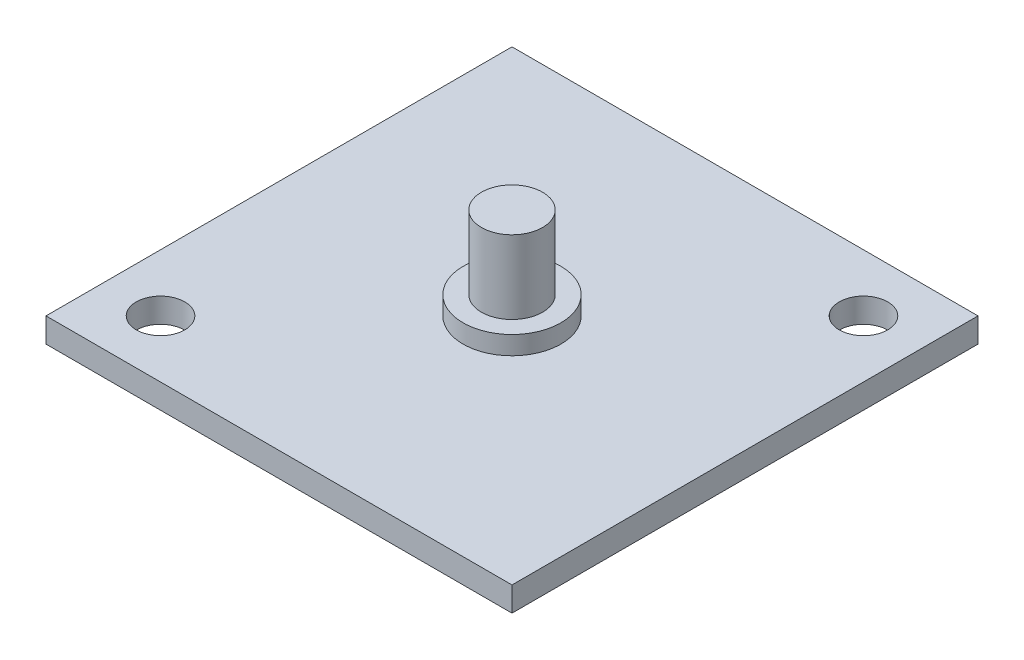
from build123d import *

# Parameters (mm, degrees)
SKETCH1_W           = 38.1
SKETCH1_H           = 38.1
SKETCH1_R           = 1.984375
BOSS_EXTRUDE1_DEPTH = 2
SKETCH2_R           = 4.0005
BOSS_EXTRUDE2_DEPTH = 1.508000032
SKETCH3_R           = 2.5
BOSS_EXTRUDE3_DEPTH = 6


with BuildPart() as part:
    # Sketch1 → Boss-Extrude1 (new body)
    with BuildSketch(Plane(origin=(0, 0, 0), x_dir=(1, 0, 0), z_dir=(0, 1, 0))):
        Rectangle(SKETCH1_W, SKETCH1_H)
        with Locations(Location((14.368409794, 14.368409794, 0), (0, 0, 270))):
            Circle(SKETCH1_R, mode=Mode.SUBTRACT)
        with Locations(Location((-14.368409794, -14.368409794, 0), (0, 0, 90))):
            Circle(SKETCH1_R, mode=Mode.SUBTRACT)
    extrude(amount=BOSS_EXTRUDE1_DEPTH)

    # Sketch2 → Boss-Extrude2 (add)
    with BuildSketch(Plane(origin=(0, 2, 0), x_dir=(1, 0, 0), z_dir=(0, 1, 0))):
        with Locations(Location((0, 0, 0), (0, 0, 90))):
            Circle(SKETCH2_R)
    extrude(amount=BOSS_EXTRUDE2_DEPTH)

    # Sketch3 → Boss-Extrude3 (add)
    with BuildSketch(Plane(origin=(0, 3.508000032, 0), x_dir=(1, 0, 0), z_dir=(0, 1, 0))):
        with Locations(Location((0, 0, 0), (0, 0, 270))):
            Circle(SKETCH3_R)
    extrude(amount=BOSS_EXTRUDE3_DEPTH)


solid = part.part
